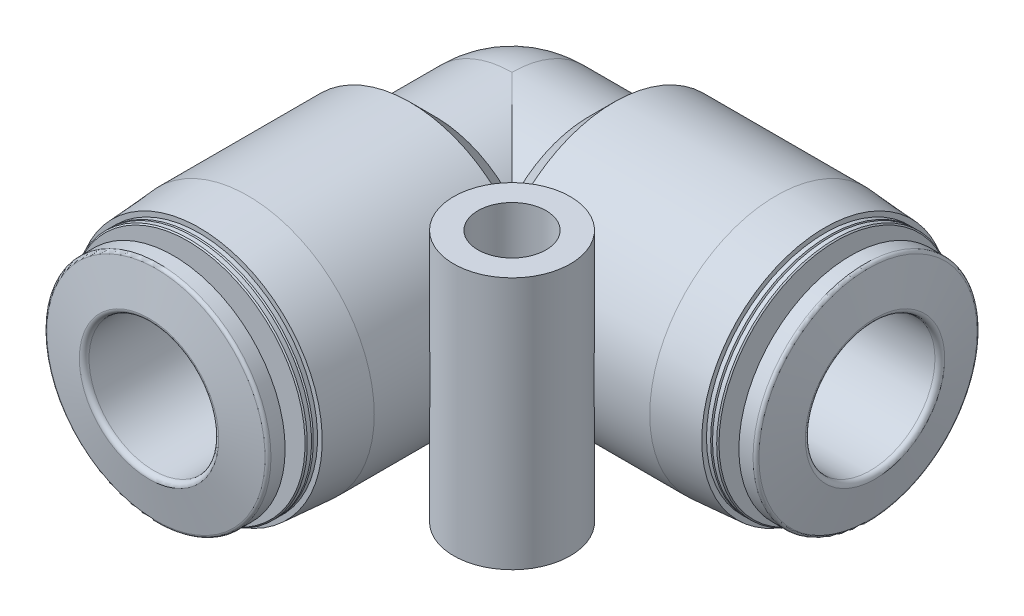
from build123d import *
from build123d.topology import SkipClean

# Parameters (mm, degrees)
AUFSATZ_LINEAR_START                 = 6.3
AUFSATZ_LINEAR_AUSTRAGEN1_DEPTH      = 6.3
AUFSATZ_LINEAR_AUSTRAGEN2_DEPTH      = 6.3
ROTATION3_ANGLE                      = 90
AUFSATZ_LINEAR_AUSTRAGEN3_DEPTH      = 1
AUFSATZ_LINEAR_AUSTRAGEN3_DEPTH_BACK = 1
SKIZZE6_W                            = 12
SKIZZE6_H                            = 12
SKIZZE7_W                            = 3.6
SKIZZE7_H                            = 15.6
BOHRUNG1_D                           = 4.2


with BuildPart() as part:
    # Skizze1 → Rotation1 (revolve)
    with BuildSketch(Plane.XY, mode=Mode.PRIVATE) as rotation1_sk:
        with BuildLine():
            Line((0, 6.24), (4.74, 6.24))
            Line((4.74, 6.24), (6.3, 7.8))
            Line((6.3, 7.8), (16.3, 7.8))
            Line((16.3, 7.8), (19.3, 7.59022))
            Line((19.3, 7.59022), (19.3, 7.3))
            Line((19.3, 7.3), (19.55691, 7.3))
            Line((19.55691, 7.3), (19.614645, 7.2))
            Line((19.614645, 7.2), (19.67238, 7.3))
            Line((19.67238, 7.3), (19.929289, 7.3))
            Line((19.929289, 7.3), (20, 7.229289))
            Line((20, 7.229289), (20, 4.7))
            Line((20, 4.7), (20.525, 4.7))
            ThreePointArc((20.525, 4.7), (20.790165, 4.809835), (20.9, 5.075))
            Line((20.9, 5.075), (20.9, 6.9))
            Line((20.9, 6.9), (21.77373, 6.9))
            ThreePointArc((21.77373, 6.9), (21.902287, 6.853209), (21.970691, 6.73473))
            Line((21.970691, 6.73473), (22.4, 4.3))
            Line((22.4, 4.3), (22.4, 0))
            Line((22.4, 0), (-6.24, 0))
            ThreePointArc((-6.24, 0), (-4.412346, 4.412346), (0, 6.24))
        make_face()
    revolve(rotation1_sk.sketch.rotate(Axis((22.4, 0, 0), (-1, 0, 0)), 270), axis=Axis((22.4, 0, 0), (-1, 0, 0)))

    # Skizze2 → Rotation2 (revolve)
    with BuildSketch(Plane(origin=(0, 0, 0), x_dir=(1, 0, 0), z_dir=(0, 1, 0)), mode=Mode.PRIVATE) as rotation2_sk:
        with BuildLine():
            Line((0, 0), (6.24, 0))
            Line((6.24, 0), (6.24, -4.74))
            Line((6.24, -4.74), (7.8, -6.3))
            Line((7.8, -6.3), (7.8, -16.3))
            Line((7.8, -16.3), (7.59022, -19.3))
            Line((7.59022, -19.3), (7.3, -19.3))
            Line((7.3, -19.3), (7.3, -19.55691))
            Line((7.3, -19.55691), (7.2, -19.614645))
            Line((7.2, -19.614645), (7.3, -19.67238))
            Line((7.3, -19.67238), (7.3, -19.929289))
            Line((7.3, -19.929289), (7.229289, -20))
            Line((7.229289, -20), (4.7, -20))
            Line((4.7, -20), (4.7, -20.525))
            ThreePointArc((4.7, -20.525), (4.809835, -20.790165), (5.075, -20.9))
            Line((5.075, -20.9), (6.9, -20.9))
            Line((6.9, -20.9), (6.9, -21.77373))
            ThreePointArc((6.9, -21.77373), (6.853209, -21.902287), (6.73473, -21.970691))
            Line((6.73473, -21.970691), (4.3, -22.4))
            Line((4.3, -22.4), (0, -22.4))
            Line((0, -22.4), (0, 0))
        make_face()
    revolve(rotation2_sk.sketch.rotate(Axis((0, 0, 22.4), (0, 0, -1)), 180), axis=Axis((0, 0, 22.4), (0, 0, -1)))

    # Skizze3 → Aufsatz-Linear austragen1 (add)
    with SkipClean():  # the faces are left unmerged after this step: merging them gives an invalid solid
        with BuildSketch(Plane(origin=(0, 0, 0), x_dir=(0, 0, -1), z_dir=(1, 0, 0)).offset(AUFSATZ_LINEAR_START)):
            with BuildLine():
                Line((4.68, 1), (4.68, -1))
                Line((4.68, -1), (7.735632, -1))
                ThreePointArc((7.735632, -1), (7.8, 0), (7.735632, 1))
                Line((7.735632, 1), (4.68, 1))
            make_face()
        extrude(amount=-AUFSATZ_LINEAR_AUSTRAGEN1_DEPTH)

    # Skizze4 → Aufsatz-Linear austragen2 (add)
    with SkipClean():  # the faces are left unmerged after this step: merging them gives an invalid solid
        with BuildSketch(Plane.XY.offset(AUFSATZ_LINEAR_START)):
            with BuildLine():
                Line((-7.735632, -1), (-4.68, -1))
                Line((-4.68, -1), (-4.68, 1))
                Line((-4.68, 1), (-7.735632, 1))
                ThreePointArc((-7.735632, 1), (-7.8, 0), (-7.735632, -1))
            make_face()
        extrude(amount=-AUFSATZ_LINEAR_AUSTRAGEN2_DEPTH)

    # Skizze5 → Rotation3 (revolve)
    with SkipClean():  # the faces are left unmerged after this step: merging them gives an invalid solid
        with BuildSketch(Plane.XY):
            with BuildLine():
                Line((-7.735632, -1), (-4.68, -1))
                Line((-4.68, -1), (-4.68, 1))
                Line((-4.68, 1), (-7.735632, 1))
                ThreePointArc((-7.735632, 1), (-7.8, 0), (-7.735632, -1))
            make_face()
        revolve(axis=Axis((0, 1, 0), (0, -1, 0)), revolution_arc=ROTATION3_ANGLE)

    # Skizze6 → Aufsatz-Linear austragen3 (add, two sides: drawn at the far end of the back side and taken through both)
    with SkipClean():  # the faces are left unmerged after this step: merging them gives an invalid solid
        with BuildSketch(Plane(origin=(0, 0, 0), x_dir=(1, 0, 0), z_dir=(0, 1, 0)).offset(-AUFSATZ_LINEAR_AUSTRAGEN3_DEPTH_BACK)):
            with Locations((6, -6)):
                Rectangle(SKIZZE6_W, SKIZZE6_H)
        extrude(amount=AUFSATZ_LINEAR_AUSTRAGEN3_DEPTH + AUFSATZ_LINEAR_AUSTRAGEN3_DEPTH_BACK)

    # Skizze7 → Rotation4 (revolve)
    with SkipClean():  # the faces are left unmerged after this step: merging them gives an invalid solid
        with BuildSketch(Plane.XY.offset(10), mode=Mode.PRIVATE) as rotation4_sk:
            with Locations((11.8, 0)):
                Rectangle(SKIZZE7_W, SKIZZE7_H)
        revolve(rotation4_sk.sketch.rotate(Axis((10, -7.8, 10), (0, 1, 0)), 90), axis=Axis((10, -7.8, 10), (0, 1, 0)))

    # Bohrung1 (through all)
    with Locations(Plane(origin=(0, -7.8, 0), x_dir=(-1, 0, 0), z_dir=(0, -1, 0))):
        with Locations((-10, -10)):
            Hole(BOHRUNG1_D / 2)

    # Skizze10 → Schnitt-Rotation1 (revolve, cut)
    with SkipClean():  # the faces are left unmerged after this step: merging them gives an invalid solid
        with BuildSketch(Plane.XY, mode=Mode.PRIVATE) as schnitt_rotation1_sk:
            with BuildLine():
                Line((0, 2.3), (4.3, 2.3))
                Line((4.3, 2.3), (4.3, 3.8))
                ThreePointArc((4.3, 3.8), (4.358579, 3.941421), (4.5, 4))
                Line((4.5, 4), (22.1, 4))
                ThreePointArc((22.1, 4), (22.312132, 4.087868), (22.4, 4.3))
                Line((22.4, 4.3), (22.4, 0))
                Line((22.4, 0), (-2.3, 0))
                ThreePointArc((-2.3, 0), (-1.626346, 1.626346), (0, 2.3))
            make_face()
        revolve(schnitt_rotation1_sk.sketch.rotate(Axis((22.4, 0, 0), (-1, 0, 0)), 90), axis=Axis((22.4, 0, 0), (-1, 0, 0)), mode=Mode.SUBTRACT)

    # Skizze11 → Schnitt-Rotation2 (revolve, cut)
    with SkipClean():  # the faces are left unmerged after this step: merging them gives an invalid solid
        with BuildSketch(Plane(origin=(0, 0, 0), x_dir=(1, 0, 0), z_dir=(0, 1, 0))):
            with BuildLine():
                Line((0, 0), (2.3, 0))
                Line((2.3, 0), (2.3, -4.3))
                Line((2.3, -4.3), (3.8, -4.3))
                ThreePointArc((3.8, -4.3), (3.941421, -4.358579), (4, -4.5))
                Line((4, -4.5), (4, -22.1))
                ThreePointArc((4, -22.1), (4.087868, -22.312132), (4.3, -22.4))
                Line((4.3, -22.4), (0, -22.4))
                Line((0, -22.4), (0, 0))
            make_face()
        revolve(axis=Axis((0, 0, 22.4), (0, 0, -1)), mode=Mode.SUBTRACT)


solid = part.part
